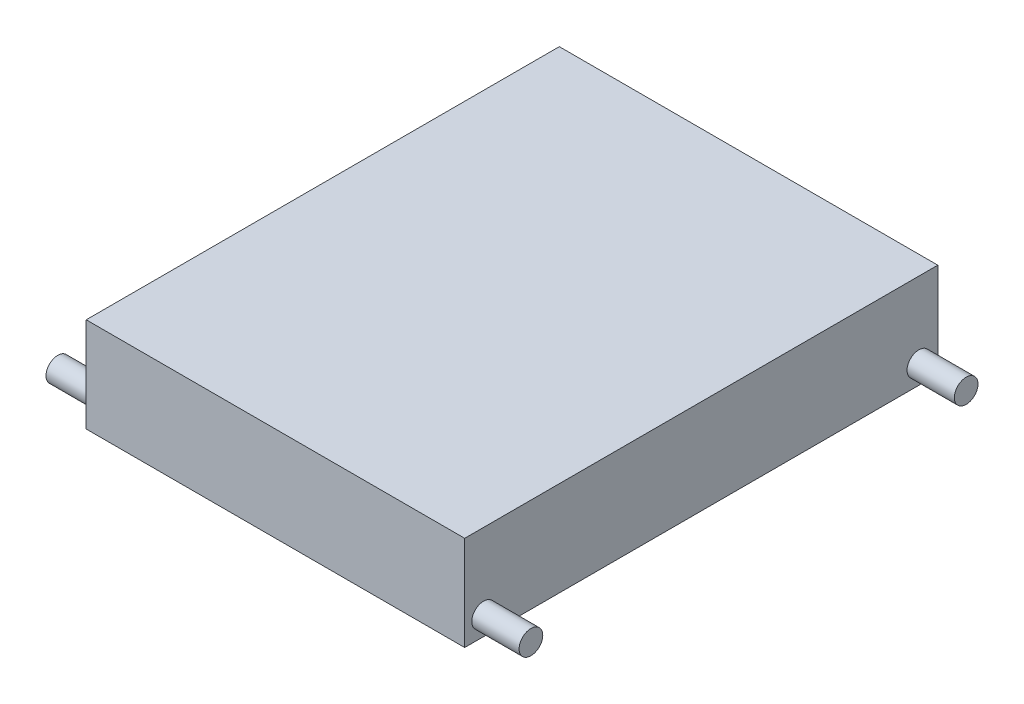
from build123d import *

# Parameters (mm, degrees)
SKETCH1_W           = 101.6
SKETCH1_H           = 127
BOSS_EXTRUDE1_DEPTH = 25.4
SKETCH2_R           = 3.175
BOSS_EXTRUDE3_DEPTH = 12.7
SKETCH3_R           = 3.175
BOSS_EXTRUDE4_DEPTH = 12.7
BOSS_EXTRUDE6_START = 12.7
SKETCH4_R           = 3.175
BOSS_EXTRUDE6_DEPTH = 12.7
BOSS_EXTRUDE7_START = 12.7
SKETCH5_R           = 3.175
BOSS_EXTRUDE7_DEPTH = 12.7


with BuildPart() as part:
    # Sketch1 → Boss-Extrude1 (new body)
    with BuildSketch(Plane(origin=(0, 0, 0), x_dir=(1, 0, 0), z_dir=(0, 1, 0))):
        with Locations((12.672921109, 45.129680171)):
            Rectangle(SKETCH1_W, SKETCH1_H)
    extrude(amount=BOSS_EXTRUDE1_DEPTH)

    # Sketch2 → Boss-Extrude3 (add)
    with BuildSketch(Plane(origin=(63.472921109, 0, 0), x_dir=(0, 0, -1), z_dir=(1, 0, 0))):
        with Locations(Location((-13.290319829, 5.08, 0), (0, 0, 180))):
            Circle(SKETCH2_R)
    extrude(amount=BOSS_EXTRUDE3_DEPTH)

    # Sketch3 → Boss-Extrude4 (add)
    with BuildSketch(Plane(origin=(63.472921109, 0, 0), x_dir=(0, 0, -1), z_dir=(1, 0, 0))):
        with Locations(Location((103.549680171, 5.08, 0), (0, 0, 180))):
            Circle(SKETCH3_R)
    extrude(amount=BOSS_EXTRUDE4_DEPTH)

    # Sketch4 → Boss-Extrude6 (add)
    with BuildSketch(Plane.ZY.offset(38.127078891).offset(BOSS_EXTRUDE6_START)):
        with Locations((-103.549680171, 5.08)):
            Circle(SKETCH4_R)
    extrude(amount=-BOSS_EXTRUDE6_DEPTH)

    # Sketch5 → Boss-Extrude7 (add)
    with BuildSketch(Plane.ZY.offset(38.127078891).offset(BOSS_EXTRUDE7_START)):
        with Locations((13.290319829, 5.08)):
            Circle(SKETCH5_R)
    extrude(amount=-BOSS_EXTRUDE7_DEPTH)


solid = part.part
